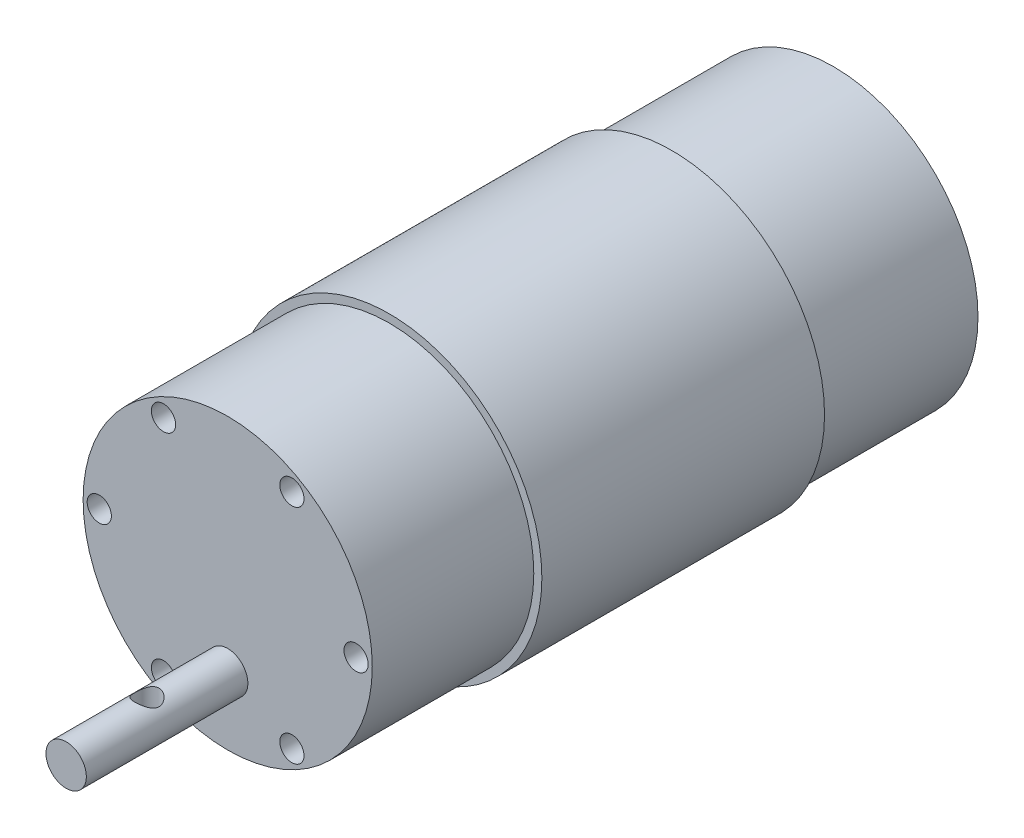
from build123d import *

# Parameters (mm, degrees)
SKETCH1_R           = 18.9
BOSS_EXTRUDE1_DEPTH = 75
SKETCH2_R           = 1.5
CUT_EXTRUDE1_DEPTH  = 8
SKETCH3_R           = 2.5
BOSS_EXTRUDE2_DEPTH = 20
CUT_EXTRUDE4_START  = -20
SKETCH5_R           = 18.9
SKETCH5_R_2         = 17.9
CUT_EXTRUDE4_DEPTH  = 20
SKETCH6_R           = 18.9
SKETCH6_R_2         = 17.9
CUT_EXTRUDE5_DEPTH  = 20
SKETCH7_R           = 1.5
CUT_EXTRUDE6_DEPTH  = 99.688499837


with BuildPart() as part:
    # Sketch1 → Boss-Extrude1 (new body)
    with BuildSketch(Plane.XY):
        Circle(SKETCH1_R)
    extrude(amount=BOSS_EXTRUDE1_DEPTH)

    # Sketch2 → Cut-Extrude1 (cut)
    with BuildSketch(Plane.XY.offset(75)):
        with Locations((15.9, 0)):
            Circle(SKETCH2_R)
        with Locations((7.95, -13.76980392)):
            Circle(SKETCH2_R)
        with Locations((-7.95, -13.76980392)):
            Circle(SKETCH2_R)
        with Locations((-15.9, 0)):
            Circle(SKETCH2_R)
        with Locations((-7.95, 13.76980392)):
            Circle(SKETCH2_R)
        with Locations((7.95, 13.76980392)):
            Circle(SKETCH2_R)
    extrude(amount=-CUT_EXTRUDE1_DEPTH, mode=Mode.SUBTRACT)

    # Sketch3 → Boss-Extrude2 (add)
    with BuildSketch(Plane.XY.offset(75)):
        with Locations((0, -9.5)):
            Circle(SKETCH3_R)
    extrude(amount=BOSS_EXTRUDE2_DEPTH)

    # Sketch5 → Cut-Extrude4 (cut)
    with BuildSketch(Plane.XY.offset(75).offset(CUT_EXTRUDE4_START)):
        Circle(SKETCH5_R)
        Circle(SKETCH5_R_2, mode=Mode.SUBTRACT)
    extrude(amount=CUT_EXTRUDE4_DEPTH, mode=Mode.SUBTRACT)

    # Sketch6 → Cut-Extrude5 (cut)
    with BuildSketch(Plane(origin=(0, 0, 0), x_dir=(-1, 0, 0), z_dir=(0, 0, -1))):
        Circle(SKETCH6_R)
        with Locations(Location((0, 0, 0), (0, 0, 180))):
            Circle(SKETCH6_R_2, mode=Mode.SUBTRACT)
    extrude(amount=-CUT_EXTRUDE5_DEPTH, mode=Mode.SUBTRACT)

    # Sketch7 → Cut-Extrude6 (cut, through all)
    with BuildSketch(Plane(origin=(0, 0, 0), x_dir=(1, 0, 0), z_dir=(0, 1, 0))):
        with Locations(Location((0, -85, 0), (0, 0, 270))):
            Circle(SKETCH7_R)
    extrude(amount=-CUT_EXTRUDE6_DEPTH, mode=Mode.SUBTRACT)


solid = part.part
